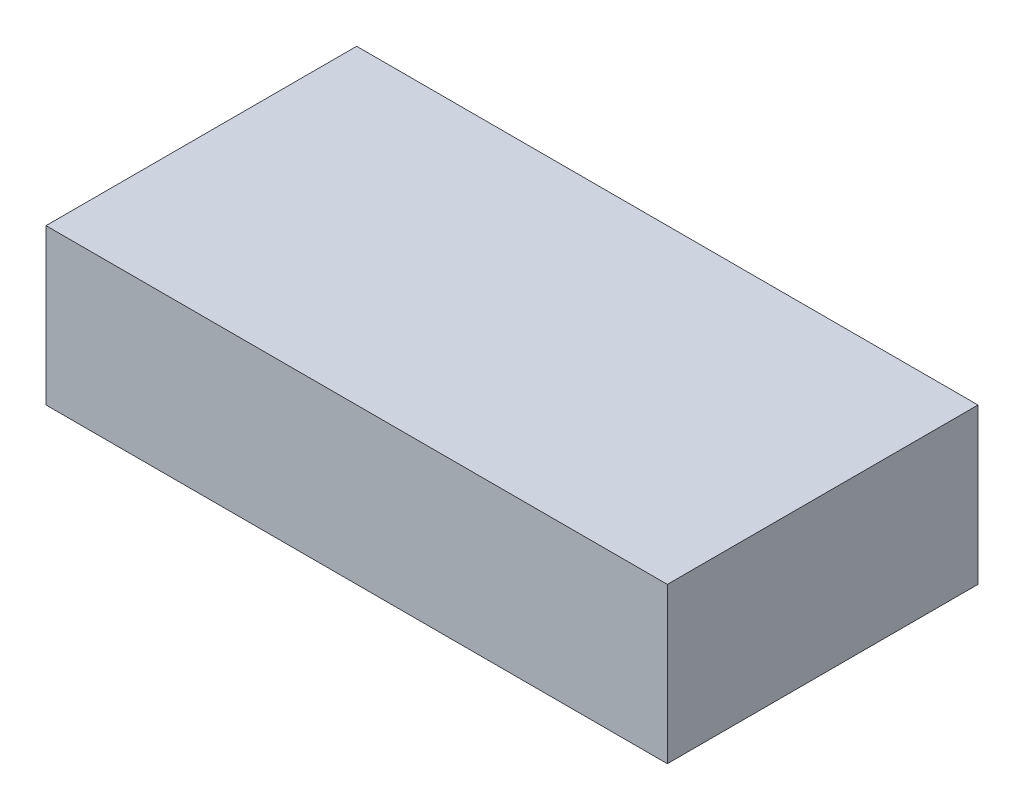
from build123d import *

# Parameters (mm, degrees)
DET2_KLEMENS_KUTUSU_DILIMI_1_START = -760
SKETCH1_W                          = 80
SKETCH1_H                          = 20
DET2_KLEMENS_KUTUSU_DILIMI_1_DEPTH = 40


with BuildPart() as part:
    # Sketch1 → DET2_klemens_kutusu_dilimi_1 (new body)
    with BuildSketch(Plane.XY.offset(DET2_KLEMENS_KUTUSU_DILIMI_1_START)):
        with Locations((1258, 1638)):
            Rectangle(SKETCH1_W, SKETCH1_H)
    extrude(amount=-DET2_KLEMENS_KUTUSU_DILIMI_1_DEPTH)


solid = part.part
